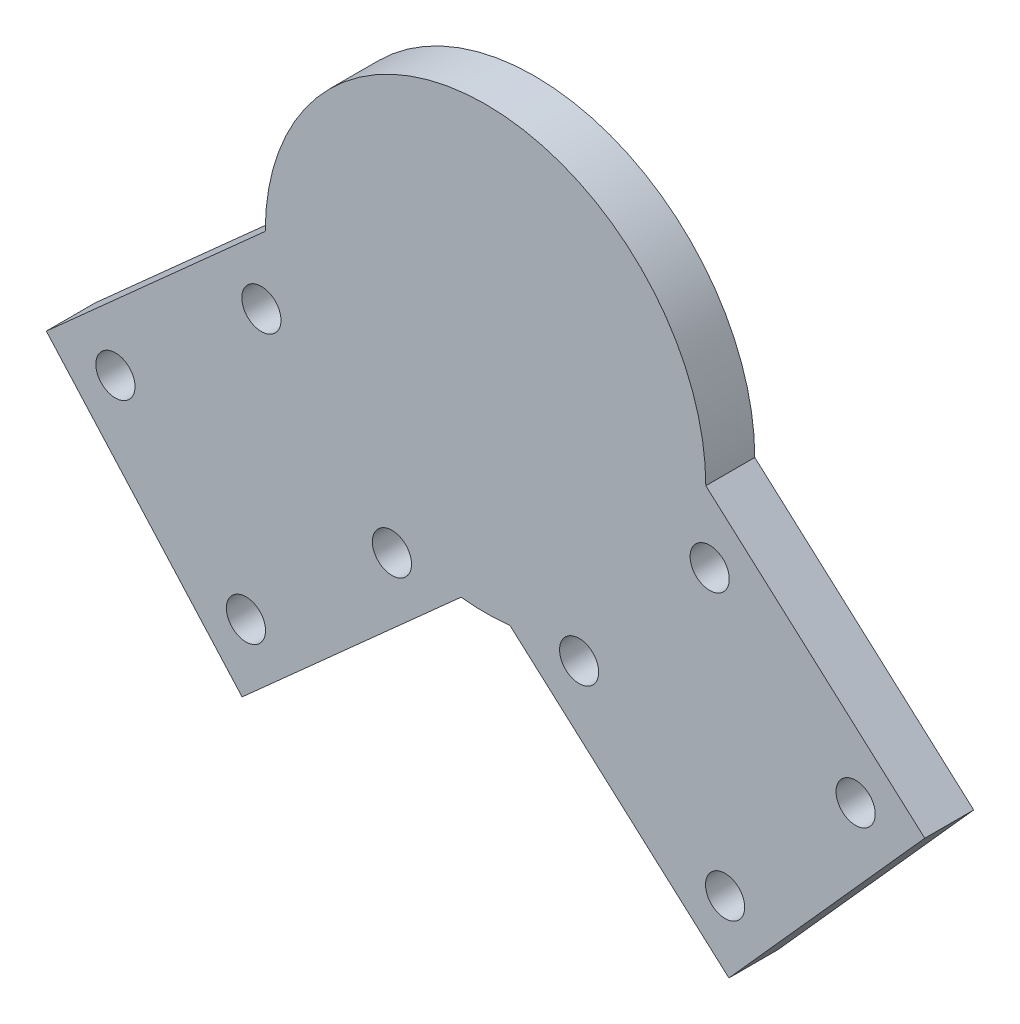
from build123d import *

# Parameters (mm, degrees)
SKETCH2_R           = 22.5
BOSS_EXTRUDE1_DEPTH = 5
SKETCH3_R           = 2
CUT_EXTRUDE1_DEPTH  = 5


with BuildPart() as part:
    # Sketch2 → Boss-Extrude1 (new body)
    with BuildSketch(Plane.XY):
        Circle(SKETCH2_R)
        Polygon((-22.5, 0), (-2.5, -22.360679775), (-24.860679775, -42.360679775), (-44.860679775, -20), align=None)
        Polygon((2.5, -22.360679775), (22.5, 0), (44.860679775, -20), (24.860679775, -42.360679775), align=None)
    extrude(amount=BOSS_EXTRUDE1_DEPTH)

    # Sketch3 → Cut-Extrude1 (cut)
    with BuildSketch(Plane(origin=(0, 0, 0), x_dir=(-1, 0, 0), z_dir=(0, 0, -1))):
        with Locations(Location((-37.800566479, -20.393446629, 0), (0, 0, 180))):
            Circle(SKETCH3_R)
        with Locations(Location((-22.893446629, -7.060113296, 0), (0, 0, 180))):
            Circle(SKETCH3_R)
        with Locations(Location((-9.560113296, -21.967233146, 0), (0, 0, 180))):
            Circle(SKETCH3_R)
        with Locations(Location((-24.467233146, -35.300566479, 0), (0, 0, 180))):
            Circle(SKETCH3_R)
        with Locations(Location((24.467233146, -35.300566479, 0), (0, 0, 180))):
            Circle(SKETCH3_R)
        with Locations(Location((37.800566479, -20.393446629, 0), (0, 0, 180))):
            Circle(SKETCH3_R)
        with Locations(Location((9.560113296, -21.967233146, 0), (0, 0, 180))):
            Circle(SKETCH3_R)
        with Locations(Location((22.893446629, -7.060113296, 0), (0, 0, 180))):
            Circle(SKETCH3_R)
    extrude(amount=-CUT_EXTRUDE1_DEPTH, mode=Mode.SUBTRACT)


solid = part.part
